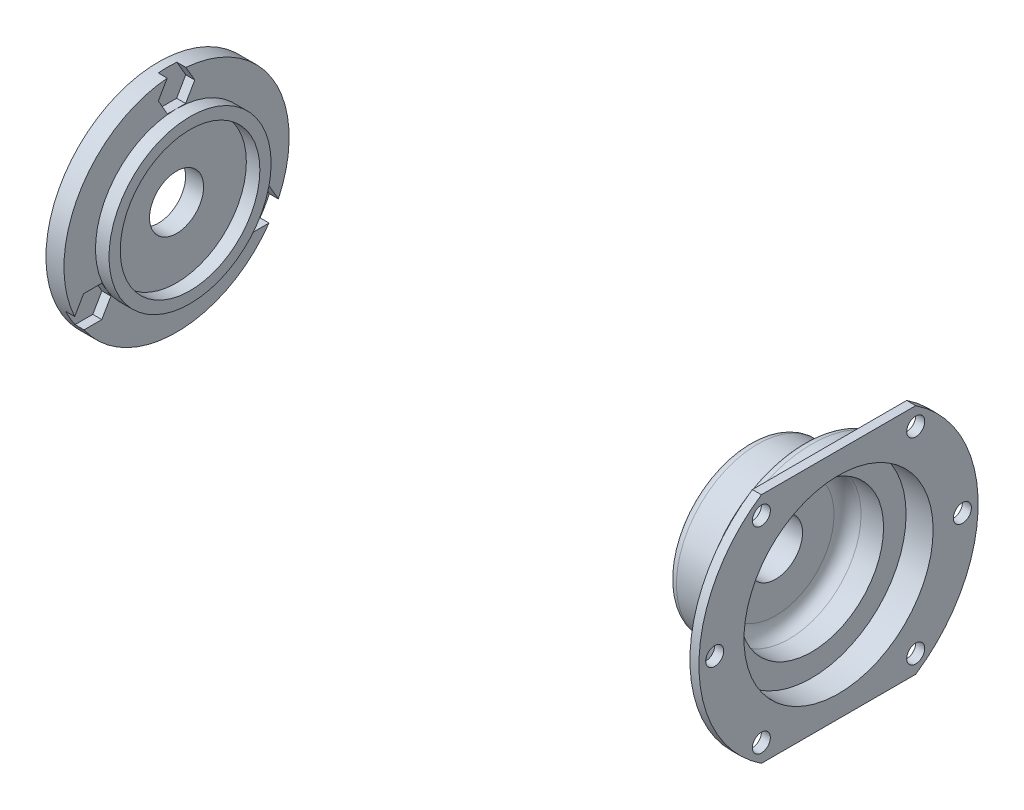
from build123d import *

# Parameters (mm, degrees)
SKETCH1_R            = 25
BOSS_EXTRUDE1_DEPTH  = 4
CUT_EXTRUDE2_DEPTH   = 2
SKETCH3_R            = 18
SKETCH3_R_2          = 15.5
BOSS_EXTRUDE2_DEPTH  = 3
SKETCH4_R            = 6
BOSS_EXTRUDE3_DEPTH  = 127
SKETCH5_R            = 18
BOSS_EXTRUDE4_DEPTH  = 12
SKETCH6_R            = 24
BOSS_EXTRUDE5_DEPTH  = 6
BOSS_EXTRUDE6_DEPTH  = 2
SKETCH9_R            = 2
CUT_EXTRUDE3_DEPTH   = 2
FILLET1_R            = 2
FILLET2_R            = 1
BOSS_EXTRUDE7_START  = 5
SKETCH10_R           = 20
BOSS_EXTRUDE7_DEPTH  = 5
BOSS_EXTRUDE8_START  = -10
SKETCH11_R           = 20
BOSS_EXTRUDE8_DEPTH  = 5
SKETCH12_R           = 17.5
BOSS_EXTRUDE9_DEPTH  = 5
CUT_EXTRUDE4_DEPTH   = 7.5
SKETCH15_W           = 65.522382653
SKETCH15_H           = 43.295416759
CUT_EXTRUDE5_DEPTH   = 32.5
SKETCH13_R           = 6
CUT_EXTRUDE6_DEPTH   = 35
SKETCH17_R           = 6
CUT_EXTRUDE8_DEPTH   = 3
SKETCH18_R           = 6
CUT_EXTRUDE9_DEPTH   = 13
SKETCH19_R           = 24
CUT_EXTRUDE10_DEPTH  = 6
SKETCH20_R           = 16
CUT_EXTRUDE11_DEPTH  = 8
FILLET3_R            = 3
SKETCH21_R           = 24
SKETCH21_R_2         = 21
BOSS_EXTRUDE10_DEPTH = 6


with BuildPart() as part:
    # Sketch1 → Boss-Extrude1 (new body)
    with BuildSketch(Plane(origin=(0, 0, 0), x_dir=(0, 0, -1), z_dir=(1, 0, 0))):
        Circle(SKETCH1_R)
    extrude(amount=BOSS_EXTRUDE1_DEPTH)

    # Sketch2 → Cut-Extrude2 (cut)
    with BuildSketch(Plane(origin=(4, 0, 0), x_dir=(0, 0, -1), z_dir=(1, 0, 0))):
        Polygon((14.578094297, -10.75), (16.598820239, -14.25), (20.640272124, -14.25), (22.660998066, -10.75), (20.640272124, -7.25), (16.598820239, -7.25), align=None)
        Polygon((2.020725942, 18), (4.041451884, 21.5), (2.020725942, 25), (-2.020725942, 25), (-4.041451884, 21.5), (-2.020725942, 18), align=None)
        Polygon((-16.598820239, -7.25), (-20.640272124, -7.25), (-22.660998066, -10.75), (-20.640272124, -14.25), (-16.598820239, -14.25), (-14.578094297, -10.75), align=None)
    extrude(amount=-CUT_EXTRUDE2_DEPTH, mode=Mode.SUBTRACT)

    # Sketch3 → Boss-Extrude2 (add)
    with BuildSketch(Plane(origin=(4, 0, 0), x_dir=(0, 0, -1), z_dir=(1, 0, 0))):
        with Locations(Location((0, 0, 0), (0, 0, 210))):
            Circle(SKETCH3_R)
        Circle(SKETCH3_R_2, mode=Mode.SUBTRACT)
    extrude(amount=BOSS_EXTRUDE2_DEPTH)

    # Sketch4 → Boss-Extrude3 (add)
    with BuildSketch(Plane(origin=(4, 0, 0), x_dir=(0, 0, -1), z_dir=(1, 0, 0))):
        Circle(SKETCH4_R)
    extrude(amount=BOSS_EXTRUDE3_DEPTH)

    # Sketch5 → Boss-Extrude4 (add)
    with BuildSketch(Plane(origin=(131, 0, 0), x_dir=(0, 0, -1), z_dir=(1, 0, 0))):
        with Locations(Location((0, 0, 0), (0, 0, 210))):
            Circle(SKETCH5_R)
    extrude(amount=BOSS_EXTRUDE4_DEPTH)

    # Sketch6 → Boss-Extrude5 (add)
    with BuildSketch(Plane(origin=(143, 0, 0), x_dir=(0, 0, -1), z_dir=(1, 0, 0))):
        Circle(SKETCH6_R)
    extrude(amount=BOSS_EXTRUDE5_DEPTH)

    # Sketch7 → Boss-Extrude6 (add)
    with BuildSketch(Plane(origin=(149, 0, 0), x_dir=(0, 0, -1), z_dir=(1, 0, 0))):
        with BuildLine():
            Line((17.13589475, 25.833333333), (-17.13589475, 25.833333333))
            ThreePointArc((-17.13589475, 25.833333333), (-31, 0), (-17.13589475, -25.833333333))
            Line((-17.13589475, -25.833333333), (17.13589475, -25.833333333))
            ThreePointArc((17.13589475, -25.833333333), (31, 0), (17.13589475, 25.833333333))
        make_face()
    extrude(amount=BOSS_EXTRUDE6_DEPTH)

    # Sketch9 → Cut-Extrude3 (cut)
    with BuildSketch(Plane(origin=(151, 0, 0), x_dir=(0, 0, -1), z_dir=(1, 0, 0))):
        with Locations((27.5, 0)):
            Circle(SKETCH9_R)
        with Locations(Location((-27.5, 0, 0), (0, 0, 180))):
            Circle(SKETCH9_R)
        with Locations((-17.13589475, 21.833333333)):
            Circle(SKETCH9_R)
        with Locations(Location((17.13589475, 21.833333333, 0), (0, 0, 180))):
            Circle(SKETCH9_R)
        with Locations((17.13589475, -21.833333333)):
            Circle(SKETCH9_R)
        with Locations(Location((-17.13589475, -21.833333333, 0), (0, 0, 180))):
            Circle(SKETCH9_R)
    extrude(amount=-CUT_EXTRUDE3_DEPTH, mode=Mode.SUBTRACT)

    # Fillet1
    fillet1_edges = [part.edges().sort_by_distance(p)[0] for p in [
        (131, 9, -15.588457268),
        (143, 0, 24),
    ]]
    fillet(fillet1_edges, radius=FILLET1_R)

    # Fillet2
    fillet2_edges = [part.edges().sort_by_distance(p)[0] for p in [
        (143, 9, -15.588457268),
    ]]
    fillet(fillet2_edges, radius=FILLET2_R)

    # Sketch10 → Boss-Extrude7 (add)
    with BuildSketch(Plane(origin=(75.5, 0, 0), x_dir=(0, 0, -1), z_dir=(1, 0, 0)).offset(BOSS_EXTRUDE7_START)):
        Circle(SKETCH10_R)
    extrude(amount=BOSS_EXTRUDE7_DEPTH)

    # Sketch11 → Boss-Extrude8 (add)
    with BuildSketch(Plane(origin=(75.5, 0, 0), x_dir=(0, 0, -1), z_dir=(1, 0, 0)).offset(BOSS_EXTRUDE8_START)):
        Circle(SKETCH11_R)
    extrude(amount=BOSS_EXTRUDE8_DEPTH)

    # Sketch12 → Boss-Extrude9 (add, symmetric)
    with BuildSketch(Plane(origin=(75.5, 0, 0), x_dir=(0, 0, -1), z_dir=(1, 0, 0))):
        Circle(SKETCH12_R)
    extrude(amount=BOSS_EXTRUDE9_DEPTH, both=True)

    # Sketch14 → Cut-Extrude4 (cut, symmetric)
    with BuildSketch(Plane.XY):
        Polygon((7, 0), (7, 6), (65.5, 6), (65.5, -6), (7, -6), align=None)
    extrude(amount=CUT_EXTRUDE4_DEPTH, both=True, mode=Mode.SUBTRACT)


with BuildPart() as cut_extrude4_piece_1:
    # of the separate pieces the step leaves, piece 1, a body of its own (cut_extrude4_pieces)
    add(part.part.solids().sort_by_distance((143, -9.5, 16.454482672))[0])

    # Sketch15 → Cut-Extrude5 (cut, symmetric)
    with BuildSketch(Plane.XY):
        with Locations((98.238808674, -1.186801276)):
            Rectangle(SKETCH15_W, SKETCH15_H)
    extrude(amount=CUT_EXTRUDE5_DEPTH, both=True, mode=Mode.SUBTRACT)

    # Sketch13 → Cut-Extrude6 (cut)
    with BuildSketch(Plane(origin=(151, 0, 0), x_dir=(0, 0, -1), z_dir=(1, 0, 0))):
        Circle(SKETCH13_R)
    extrude(amount=-CUT_EXTRUDE6_DEPTH, mode=Mode.SUBTRACT)

    # Sketch19 → Cut-Extrude10 (cut)
    with BuildSketch(Plane(origin=(151, 0, 0), x_dir=(0, 0, -1), z_dir=(1, 0, 0))):
        Circle(SKETCH19_R)
    extrude(amount=-CUT_EXTRUDE10_DEPTH, mode=Mode.SUBTRACT)


with BuildPart() as cut_extrude4_piece_2:
    # of the separate pieces the step leaves, piece 2, a body of its own (cut_extrude4_pieces)
    add(part.part.solids().sort_by_distance((4, 0, -6))[0])

    # Sketch17 → Cut-Extrude8 (cut)
    with BuildSketch(Plane(origin=(7, 0, 0), x_dir=(0, 0, -1), z_dir=(1, 0, 0))):
        Circle(SKETCH17_R)
    extrude(amount=-CUT_EXTRUDE8_DEPTH, mode=Mode.SUBTRACT)

    # Sketch18 → Cut-Extrude9 (cut)
    with BuildSketch(Plane(origin=(4, 0, 0), x_dir=(0, 0, -1), z_dir=(1, 0, 0))):
        Circle(SKETCH18_R)
    extrude(amount=-CUT_EXTRUDE9_DEPTH, mode=Mode.SUBTRACT)


with BuildPart() as cut_extrude10_piece_1:
    # of the separate pieces the step leaves, piece 1, a body of its own (cut_extrude10_pieces)
    add(cut_extrude4_piece_1.part.solids().sort_by_distance((143, -9.5, 16.454482672))[0])

    # Sketch20 → Cut-Extrude11 (cut)
    with BuildSketch(Plane(origin=(145, 0, 0), x_dir=(0, 0, -1), z_dir=(1, 0, 0))):
        Circle(SKETCH20_R)
    extrude(amount=-CUT_EXTRUDE11_DEPTH, mode=Mode.SUBTRACT)

    # Fillet3
    fillet3_edges = [cut_extrude10_piece_1.edges().sort_by_distance(p)[0] for p in [
        (137, 0, 16),
    ]]
    fillet(fillet3_edges, radius=FILLET3_R)



with BuildPart() as cut_extrude10_piece_2:
    # of the separate pieces the step leaves, piece 2, a body of its own (cut_extrude10_pieces)
    add(cut_extrude4_piece_1.part.solids().sort_by_distance((149, 25.833333333, -17.13589475))[0])


with BuildPart() as cut_extrude10_piece_1_1:
    add(cut_extrude10_piece_1.part)

    add(cut_extrude10_piece_2.part)  # Boss-Extrude10 merges Cut-Extrude10 piece 2
    # Sketch21 → Boss-Extrude10 (add)
    with BuildSketch(Plane(origin=(145, 0, 0), x_dir=(0, 0, -1), z_dir=(1, 0, 0))):
        Circle(SKETCH21_R)
        Circle(SKETCH21_R_2, mode=Mode.SUBTRACT)
    extrude(amount=BOSS_EXTRUDE10_DEPTH)


solid = Compound([cut_extrude4_piece_2.part, cut_extrude10_piece_1_1.part])
